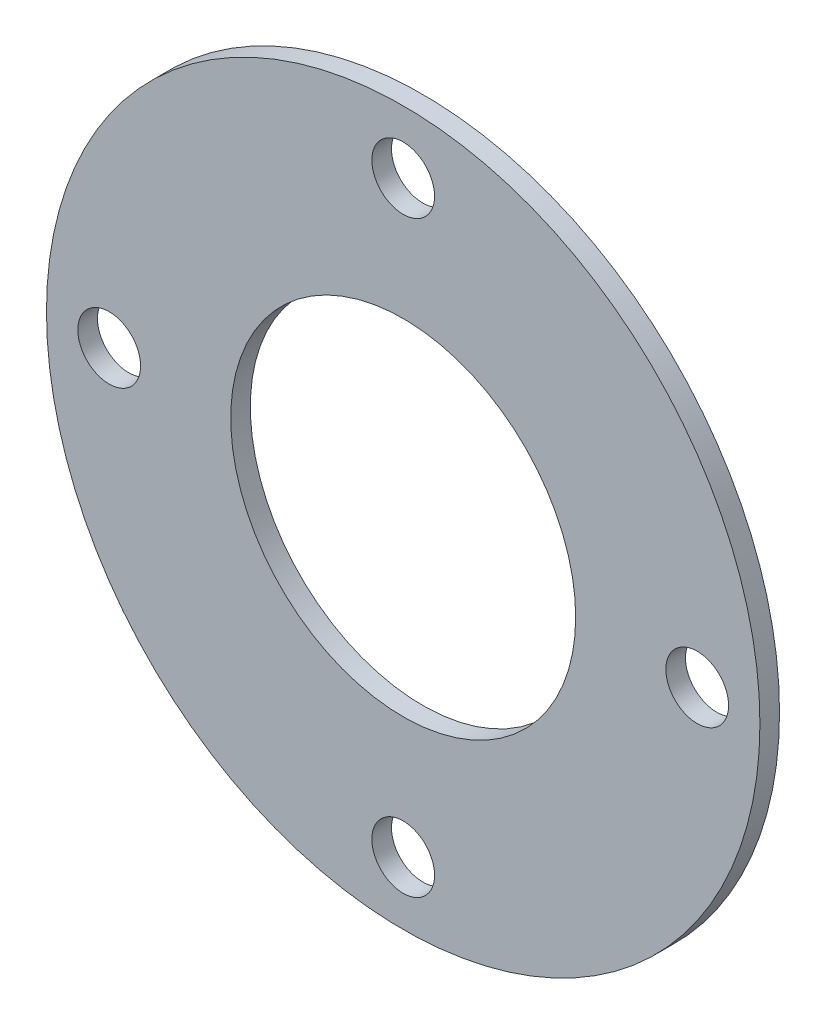
from build123d import *

# Parameters (mm, degrees)
CARRIER_REAR_START  = 32
SKETCH_1_R          = 45.5
SKETCH_1_R_2        = 22
CARRIER_REAR_DEPTH  = 2.5
SKETCH_2_R          = 4
THROUGH_HOLES_DEPTH = 100


with BuildPart() as part:
    # Эскиз1 → Carrier_rear (new body)
    with BuildSketch(Plane.XY.offset(CARRIER_REAR_START)):
        Circle(SKETCH_1_R)
        Circle(SKETCH_1_R_2, mode=Mode.SUBTRACT)
    extrude(amount=CARRIER_REAR_DEPTH)

    # Эскиз2 → Through_holes (cut, symmetric)
    with BuildSketch(Plane.XY):
        with Locations((37.5, 0)):
            Circle(SKETCH_2_R)
        with Locations((0, 37.5)):
            Circle(SKETCH_2_R)
        with Locations((-37.5, 0)):
            Circle(SKETCH_2_R)
        with Locations((0, -37.5)):
            Circle(SKETCH_2_R)
    extrude(amount=THROUGH_HOLES_DEPTH, both=True, mode=Mode.SUBTRACT)


solid = part.part
